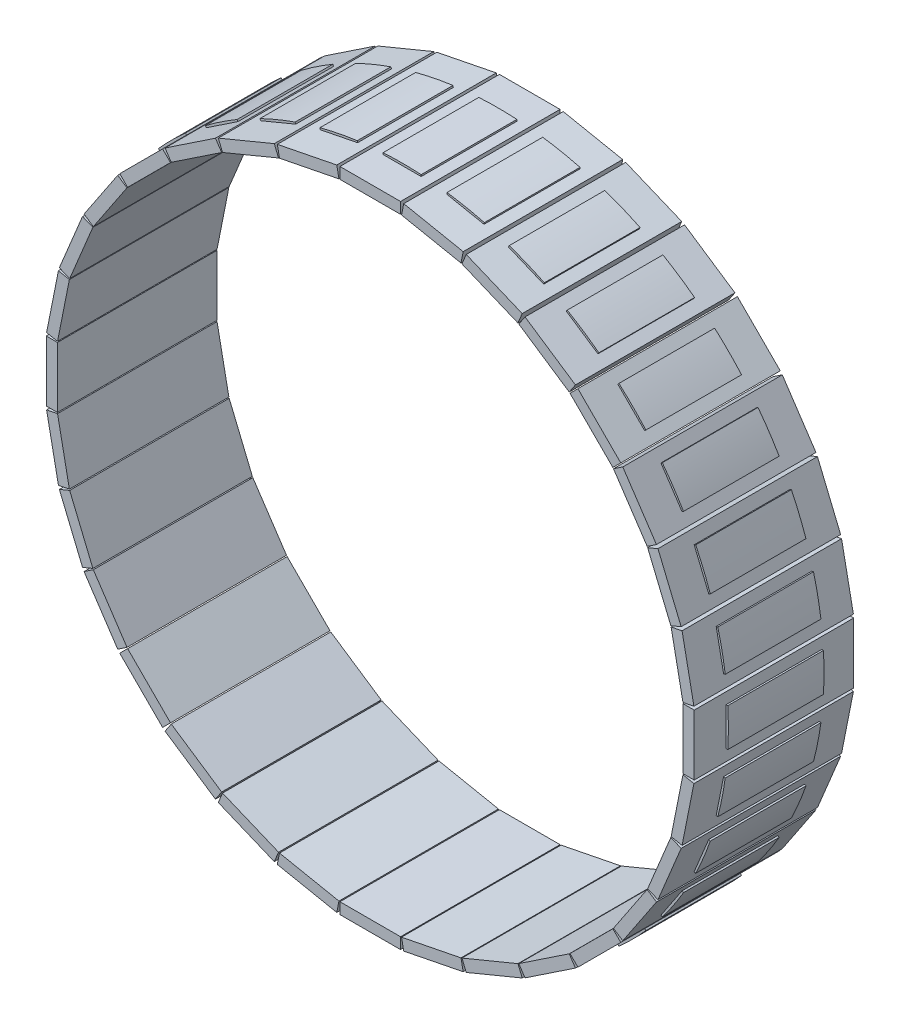
from build123d import *

# Parameters (mm, degrees)
SKETCH_1_W         = 19
SKETCH_1_H         = 3.5
EXTRUDE_1_DEPTH    = 50
EXTRUDE_1_2_DEPTH  = 50
EXTRUDE_1_3_DEPTH  = 50
EXTRUDE_1_4_DEPTH  = 50
EXTRUDE_1_5_DEPTH  = 50
EXTRUDE_1_6_DEPTH  = 50
EXTRUDE_1_7_DEPTH  = 50
EXTRUDE_1_8_DEPTH  = 50
SKETCH_1_W_2       = 3.5
SKETCH_1_H_2       = 19
EXTRUDE_1_9_DEPTH  = 50
EXTRUDE_1_10_DEPTH = 50
EXTRUDE_1_11_DEPTH = 50
EXTRUDE_1_12_DEPTH = 50
EXTRUDE_1_13_DEPTH = 50
EXTRUDE_1_14_DEPTH = 50
EXTRUDE_1_15_DEPTH = 50
EXTRUDE_1_16_DEPTH = 50
EXTRUDE_1_17_DEPTH = 50
EXTRUDE_1_18_DEPTH = 50
EXTRUDE_1_19_DEPTH = 50
EXTRUDE_1_20_DEPTH = 50
EXTRUDE_1_21_DEPTH = 50
EXTRUDE_1_22_DEPTH = 50
EXTRUDE_1_23_DEPTH = 50
EXTRUDE_1_24_DEPTH = 50
EXTRUDE_1_25_DEPTH = 50
EXTRUDE_1_26_DEPTH = 50
EXTRUDE_1_27_DEPTH = 50
EXTRUDE_1_28_DEPTH = 50
EXTRUDE_1_29_DEPTH = 50
EXTRUDE_1_30_DEPTH = 50
EXTRUDE_1_31_DEPTH = 50
EXTRUDE_1_32_DEPTH = 50
EXTRUDE_START      = -10
EXTRUDE_2_DEPTH    = 30


with BuildPart() as part:
    # Эскиз1 → Бобышка-Вытянуть1 (new body)
    with BuildSketch(Plane.XY):
        with Locations((0, 99.806634446)):
            Rectangle(SKETCH_1_W, SKETCH_1_H)
    extrude(amount=EXTRUDE_1_DEPTH)

    # Эскиз2 → Бобышка-Вытянуть2 (add)
    with BuildSketch(Plane.XY.offset(50).offset(EXTRUDE_START)):
        with BuildLine():
            Line((-5.965692054, 102.075819949), (-5.965692054, 100.533088049))
            Line((-5.965692054, 100.533088049), (5.965692054, 100.533088049))
            Line((5.965692054, 100.533088049), (5.965692054, 102.075819949))
            ThreePointArc((5.965692054, 102.075819949), (0, 102.25), (-5.965692054, 102.075819949))
        make_face()
        with BuildLine():
            Line((25.464095475, 97.437524168), (25.765067538, 98.950612907))
            ThreePointArc((25.765067538, 98.950612907), (19.947985426, 100.285294921), (14.06294163, 101.278310475))
            Line((14.06294163, 101.278310475), (13.761969566, 99.765221736))
            Line((13.761969566, 99.765221736), (25.464095475, 97.437524168))
        make_face()
        with BuildLine():
            Line((43.983927987, 90.597490877), (44.574305926, 92.022789304))
            ThreePointArc((44.574305926, 92.022789304), (39.129380959, 94.466682199), (33.551144353, 96.588732327))
            Line((33.551144353, 96.588732327), (32.960766414, 95.1634339))
            Line((32.960766414, 95.1634339), (43.983927987, 90.597490877))
        make_face()
        with BuildLine():
            Line((60.813482813, 80.275846819), (61.670578734, 81.558581514))
            ThreePointArc((61.670578734, 81.558581514), (56.807056326, 85.017767858), (51.749995415, 88.187303363))
            Line((51.749995415, 88.187303363), (50.892899494, 86.904568668))
            Line((50.892899494, 86.904568668), (60.813482813, 80.275846819))
        make_face()
        with BuildLine():
            Line((75.306009599, 66.869246987), (76.396885787, 67.960123175))
            ThreePointArc((76.396885787, 67.960123175), (72.301668376, 72.301668376), (67.960123175, 76.396885787))
            Line((67.960123175, 76.396885787), (66.869246987, 75.306009599))
            Line((66.869246987, 75.306009599), (75.306009599, 66.869246987))
        make_face()
        with BuildLine():
            Line((86.904568668, 50.892899494), (88.187303363, 51.749995415))
            ThreePointArc((88.187303363, 51.749995415), (85.017767858, 56.807056326), (81.558581514, 61.670578734))
            Line((81.558581514, 61.670578734), (80.275846819, 60.813482813))
            Line((80.275846819, 60.813482813), (86.904568668, 50.892899494))
        make_face()
        with BuildLine():
            Line((95.1634339, 32.960766414), (96.588732327, 33.551144353))
            ThreePointArc((96.588732327, 33.551144353), (94.466682199, 39.129380959), (92.022789304, 44.574305926))
            Line((92.022789304, 44.574305926), (90.597490877, 43.983927987))
            Line((90.597490877, 43.983927987), (95.1634339, 32.960766414))
        make_face()
        with BuildLine():
            Line((99.765221736, 13.761969566), (101.278310475, 14.06294163))
            ThreePointArc((101.278310475, 14.06294163), (100.285294921, 19.947985426), (98.950612907, 25.765067538))
            Line((98.950612907, 25.765067538), (97.437524168, 25.464095475))
            Line((97.437524168, 25.464095475), (99.765221736, 13.761969566))
        make_face()
        with BuildLine():
            Line((100.533088049, -5.965692054), (102.075819949, -5.965692054))
            ThreePointArc((102.075819949, -5.965692054), (102.25, 0), (102.075819949, 5.965692054))
            Line((102.075819949, 5.965692054), (100.533088049, 5.965692054))
            Line((100.533088049, 5.965692054), (100.533088049, -5.965692054))
        make_face()
        with BuildLine():
            Line((97.437524168, -25.464095475), (98.950612907, -25.765067538))
            ThreePointArc((98.950612907, -25.765067538), (100.285294921, -19.947985426), (101.278310475, -14.06294163))
            Line((101.278310475, -14.06294163), (99.765221736, -13.761969566))
            Line((99.765221736, -13.761969566), (97.437524168, -25.464095475))
        make_face()
        with BuildLine():
            Line((90.597490877, -43.983927987), (92.022789304, -44.574305926))
            ThreePointArc((92.022789304, -44.574305926), (94.466682199, -39.129380959), (96.588732327, -33.551144353))
            Line((96.588732327, -33.551144353), (95.1634339, -32.960766414))
            Line((95.1634339, -32.960766414), (90.597490877, -43.983927987))
        make_face()
        with BuildLine():
            Line((80.275846819, -60.813482813), (81.558581514, -61.670578734))
            ThreePointArc((81.558581514, -61.670578734), (85.017767858, -56.807056326), (88.187303363, -51.749995415))
            Line((88.187303363, -51.749995415), (86.904568668, -50.892899494))
            Line((86.904568668, -50.892899494), (80.275846819, -60.813482813))
        make_face()
        with BuildLine():
            Line((66.869246987, -75.306009599), (67.960123175, -76.396885787))
            ThreePointArc((67.960123175, -76.396885787), (72.301668376, -72.301668376), (76.396885787, -67.960123175))
            Line((76.396885787, -67.960123175), (75.306009599, -66.869246987))
            Line((75.306009599, -66.869246987), (66.869246987, -75.306009599))
        make_face()
        with BuildLine():
            Line((50.892899494, -86.904568668), (51.749995415, -88.187303363))
            ThreePointArc((51.749995415, -88.187303363), (56.807056326, -85.017767858), (61.670578734, -81.558581514))
            Line((61.670578734, -81.558581514), (60.813482813, -80.275846819))
            Line((60.813482813, -80.275846819), (50.892899494, -86.904568668))
        make_face()
        with BuildLine():
            Line((32.960766414, -95.1634339), (33.551144353, -96.588732327))
            ThreePointArc((33.551144353, -96.588732327), (39.129380959, -94.466682199), (44.574305926, -92.022789304))
            Line((44.574305926, -92.022789304), (43.983927987, -90.597490877))
            Line((43.983927987, -90.597490877), (32.960766414, -95.1634339))
        make_face()
        with BuildLine():
            Line((13.761969566, -99.765221736), (14.06294163, -101.278310475))
            ThreePointArc((14.06294163, -101.278310475), (19.947985426, -100.285294921), (25.765067538, -98.950612907))
            Line((25.765067538, -98.950612907), (25.464095475, -97.437524168))
            Line((25.464095475, -97.437524168), (13.761969566, -99.765221736))
        make_face()
        with BuildLine():
            Line((-5.965692054, -100.533088049), (-5.965692054, -102.075819949))
            ThreePointArc((-5.965692054, -102.075819949), (0, -102.25), (5.965692054, -102.075819949))
            Line((5.965692054, -102.075819949), (5.965692054, -100.533088049))
            Line((5.965692054, -100.533088049), (-5.965692054, -100.533088049))
        make_face()
        with BuildLine():
            Line((-25.464095475, -97.437524168), (-25.765067538, -98.950612907))
            ThreePointArc((-25.765067538, -98.950612907), (-19.947985426, -100.285294921), (-14.06294163, -101.278310475))
            Line((-14.06294163, -101.278310475), (-13.761969566, -99.765221736))
            Line((-13.761969566, -99.765221736), (-25.464095475, -97.437524168))
        make_face()
        with BuildLine():
            Line((-43.983927987, -90.597490877), (-44.574305926, -92.022789304))
            ThreePointArc((-44.574305926, -92.022789304), (-39.129380959, -94.466682199), (-33.551144353, -96.588732327))
            Line((-33.551144353, -96.588732327), (-32.960766414, -95.1634339))
            Line((-32.960766414, -95.1634339), (-43.983927987, -90.597490877))
        make_face()
        with BuildLine():
            Line((-60.813482813, -80.275846819), (-61.670578734, -81.558581514))
            ThreePointArc((-61.670578734, -81.558581514), (-56.807056326, -85.017767858), (-51.749995415, -88.187303363))
            Line((-51.749995415, -88.187303363), (-50.892899494, -86.904568668))
            Line((-50.892899494, -86.904568668), (-60.813482813, -80.275846819))
        make_face()
        with BuildLine():
            Line((-75.306009599, -66.869246987), (-76.396885787, -67.960123175))
            ThreePointArc((-76.396885787, -67.960123175), (-72.301668376, -72.301668376), (-67.960123175, -76.396885787))
            Line((-67.960123175, -76.396885787), (-66.869246987, -75.306009599))
            Line((-66.869246987, -75.306009599), (-75.306009599, -66.869246987))
        make_face()
        with BuildLine():
            Line((-86.904568668, -50.892899494), (-88.187303363, -51.749995415))
            ThreePointArc((-88.187303363, -51.749995415), (-85.017767858, -56.807056326), (-81.558581514, -61.670578734))
            Line((-81.558581514, -61.670578734), (-80.275846819, -60.813482813))
            Line((-80.275846819, -60.813482813), (-86.904568668, -50.892899494))
        make_face()
        with BuildLine():
            Line((-95.1634339, -32.960766414), (-96.588732327, -33.551144353))
            ThreePointArc((-96.588732327, -33.551144353), (-94.466682199, -39.129380959), (-92.022789304, -44.574305926))
            Line((-92.022789304, -44.574305926), (-90.597490877, -43.983927987))
            Line((-90.597490877, -43.983927987), (-95.1634339, -32.960766414))
        make_face()
        with BuildLine():
            Line((-99.765221736, -13.761969566), (-101.278310475, -14.06294163))
            ThreePointArc((-101.278310475, -14.06294163), (-100.285294921, -19.947985426), (-98.950612907, -25.765067538))
            Line((-98.950612907, -25.765067538), (-97.437524168, -25.464095475))
            Line((-97.437524168, -25.464095475), (-99.765221736, -13.761969566))
        make_face()
        with BuildLine():
            Line((-100.533088049, 5.965692054), (-102.075819949, 5.965692054))
            ThreePointArc((-102.075819949, 5.965692054), (-102.25, 0), (-102.075819949, -5.965692054))
            Line((-102.075819949, -5.965692054), (-100.533088049, -5.965692054))
            Line((-100.533088049, -5.965692054), (-100.533088049, 5.965692054))
        make_face()
        with BuildLine():
            Line((-97.437524168, 25.464095475), (-98.950612907, 25.765067538))
            ThreePointArc((-98.950612907, 25.765067538), (-100.285294921, 19.947985426), (-101.278310475, 14.06294163))
            Line((-101.278310475, 14.06294163), (-99.765221736, 13.761969566))
            Line((-99.765221736, 13.761969566), (-97.437524168, 25.464095475))
        make_face()
        with BuildLine():
            Line((-90.597490877, 43.983927987), (-92.022789304, 44.574305926))
            ThreePointArc((-92.022789304, 44.574305926), (-94.466682199, 39.129380959), (-96.588732327, 33.551144353))
            Line((-96.588732327, 33.551144353), (-95.1634339, 32.960766414))
            Line((-95.1634339, 32.960766414), (-90.597490877, 43.983927987))
        make_face()
        with BuildLine():
            Line((-80.275846819, 60.813482813), (-81.558581514, 61.670578734))
            ThreePointArc((-81.558581514, 61.670578734), (-85.017767858, 56.807056326), (-88.187303363, 51.749995415))
            Line((-88.187303363, 51.749995415), (-86.904568668, 50.892899494))
            Line((-86.904568668, 50.892899494), (-80.275846819, 60.813482813))
        make_face()
        with BuildLine():
            Line((-66.869246987, 75.306009599), (-67.960123175, 76.396885787))
            ThreePointArc((-67.960123175, 76.396885787), (-72.301668376, 72.301668376), (-76.396885787, 67.960123175))
            Line((-76.396885787, 67.960123175), (-75.306009599, 66.869246987))
            Line((-75.306009599, 66.869246987), (-66.869246987, 75.306009599))
        make_face()
        with BuildLine():
            Line((-50.892899494, 86.904568668), (-51.749995415, 88.187303363))
            ThreePointArc((-51.749995415, 88.187303363), (-56.807056326, 85.017767858), (-61.670578734, 81.558581514))
            Line((-61.670578734, 81.558581514), (-60.813482813, 80.275846819))
            Line((-60.813482813, 80.275846819), (-50.892899494, 86.904568668))
        make_face()
        with BuildLine():
            Line((-32.960766414, 95.1634339), (-33.551144353, 96.588732327))
            ThreePointArc((-33.551144353, 96.588732327), (-39.129380959, 94.466682199), (-44.574305926, 92.022789304))
            Line((-44.574305926, 92.022789304), (-43.983927987, 90.597490877))
            Line((-43.983927987, 90.597490877), (-32.960766414, 95.1634339))
        make_face()
        with BuildLine():
            Line((-13.761969566, 99.765221736), (-14.06294163, 101.278310475))
            ThreePointArc((-14.06294163, 101.278310475), (-19.947985426, 100.285294921), (-25.765067538, 98.950612907))
            Line((-25.765067538, 98.950612907), (-25.464095475, 97.437524168))
            Line((-25.464095475, 97.437524168), (-13.761969566, 99.765221736))
        make_face()
    extrude(amount=-EXTRUDE_2_DEPTH)


with BuildPart() as body_2:
    # Эскиз1 → Extrude 1 2 (new body)
    with BuildSketch(Plane.XY):
        Polygon((10.495256353, 101.458610251), (9.812440226, 98.02586177), (28.447360554, 94.319145651), (29.130176681, 97.751894133), align=None)
    extrude(amount=EXTRUDE_1_2_DEPTH)


with BuildPart() as body_3:
    # Эскиз1 → Extrude 1 3 (new body)
    with BuildSketch(Plane.XY):
        Polygon((30.08718589, 97.461588563), (28.747793877, 94.228010199), (46.301504995, 86.957024984), (47.640897008, 90.190603348), align=None)
    extrude(amount=EXTRUDE_1_3_DEPTH)


with BuildPart() as body_4:
    # Эскиз1 → Extrude 1 4 (new body)
    with BuildSketch(Plane.XY):
        Polygon((48.522881747, 89.719172683), (46.578385931, 86.80902904), (62.376308565, 76.253194613), (64.320804381, 79.163338256), align=None)
    extrude(amount=EXTRUDE_1_4_DEPTH)


with BuildPart() as body_5:
    # Эскиз1 → Extrude 1 5 (new body)
    with BuildSketch(Plane.XY):
        Polygon((65.09387047, 78.528899313), (62.618996736, 76.054025578), (76.054025578, 62.618996736), (78.528899313, 65.09387047), align=None)
    extrude(amount=EXTRUDE_1_5_DEPTH)


with BuildPart() as body_6:
    # Эскиз1 → Extrude 1 6 (new body)
    with BuildSketch(Plane.XY):
        Polygon((79.163338256, 64.320804381), (76.253194613, 62.376308565), (86.80902904, 46.578385931), (89.719172683, 48.522881747), align=None)
    extrude(amount=EXTRUDE_1_6_DEPTH)


with BuildPart() as body_7:
    # Эскиз1 → Extrude 1 7 (new body)
    with BuildSketch(Plane.XY):
        Polygon((90.190603348, 47.640897008), (86.957024984, 46.301504995), (94.228010199, 28.747793877), (97.461588563, 30.08718589), align=None)
    extrude(amount=EXTRUDE_1_7_DEPTH)


with BuildPart() as body_8:
    # Эскиз1 → Extrude 1 8 (new body)
    with BuildSketch(Plane.XY):
        Polygon((97.751894133, 29.130176681), (94.319145651, 28.447360554), (98.02586177, 9.812440226), (101.458610251, 10.495256353), align=None)
    extrude(amount=EXTRUDE_1_8_DEPTH)


with BuildPart() as body_9:
    # Эскиз1 → Extrude 1 9 (new body)
    with BuildSketch(Plane.XY):
        with Locations((99.806634446, 0)):
            Rectangle(SKETCH_1_W_2, SKETCH_1_H_2)
    extrude(amount=EXTRUDE_1_9_DEPTH)


with BuildPart() as body_10:
    # Эскиз1 → Extrude 1 10 (new body)
    with BuildSketch(Plane.XY):
        Polygon((101.458610251, -10.495256353), (98.02586177, -9.812440226), (94.319145651, -28.447360554), (97.751894133, -29.130176681), align=None)
    extrude(amount=EXTRUDE_1_10_DEPTH)


with BuildPart() as body_11:
    # Эскиз1 → Extrude 1 11 (new body)
    with BuildSketch(Plane.XY):
        Polygon((97.461588563, -30.08718589), (94.228010199, -28.747793877), (86.957024984, -46.301504995), (90.190603348, -47.640897008), align=None)
    extrude(amount=EXTRUDE_1_11_DEPTH)


with BuildPart() as body_12:
    # Эскиз1 → Extrude 1 12 (new body)
    with BuildSketch(Plane.XY):
        Polygon((89.719172683, -48.522881747), (86.80902904, -46.578385931), (76.253194613, -62.376308565), (79.163338256, -64.320804381), align=None)
    extrude(amount=EXTRUDE_1_12_DEPTH)


with BuildPart() as body_13:
    # Эскиз1 → Extrude 1 13 (new body)
    with BuildSketch(Plane.XY):
        Polygon((78.528899313, -65.09387047), (76.054025578, -62.618996736), (62.618996736, -76.054025578), (65.09387047, -78.528899313), align=None)
    extrude(amount=EXTRUDE_1_13_DEPTH)


with BuildPart() as body_14:
    # Эскиз1 → Extrude 1 14 (new body)
    with BuildSketch(Plane.XY):
        Polygon((64.320804381, -79.163338256), (62.376308565, -76.253194613), (46.578385931, -86.80902904), (48.522881747, -89.719172683), align=None)
    extrude(amount=EXTRUDE_1_14_DEPTH)


with BuildPart() as body_15:
    # Эскиз1 → Extrude 1 15 (new body)
    with BuildSketch(Plane.XY):
        Polygon((47.640897008, -90.190603348), (46.301504995, -86.957024984), (28.747793877, -94.228010199), (30.08718589, -97.461588563), align=None)
    extrude(amount=EXTRUDE_1_15_DEPTH)


with BuildPart() as body_16:
    # Эскиз1 → Extrude 1 16 (new body)
    with BuildSketch(Plane.XY):
        Polygon((29.130176681, -97.751894133), (28.447360554, -94.319145651), (9.812440226, -98.02586177), (10.495256353, -101.458610251), align=None)
    extrude(amount=EXTRUDE_1_16_DEPTH)


with BuildPart() as body_17:
    # Эскиз1 → Extrude 1 17 (new body)
    with BuildSketch(Plane.XY):
        with Locations((0, -99.806634446)):
            Rectangle(SKETCH_1_W, SKETCH_1_H)
    extrude(amount=EXTRUDE_1_17_DEPTH)


with BuildPart() as body_18:
    # Эскиз1 → Extrude 1 18 (new body)
    with BuildSketch(Plane.XY):
        Polygon((-10.495256353, -101.458610251), (-9.812440226, -98.02586177), (-28.447360554, -94.319145651), (-29.130176681, -97.751894133), align=None)
    extrude(amount=EXTRUDE_1_18_DEPTH)


with BuildPart() as body_19:
    # Эскиз1 → Extrude 1 19 (new body)
    with BuildSketch(Plane.XY):
        Polygon((-30.08718589, -97.461588563), (-28.747793877, -94.228010199), (-46.301504995, -86.957024984), (-47.640897008, -90.190603348), align=None)
    extrude(amount=EXTRUDE_1_19_DEPTH)


with BuildPart() as body_20:
    # Эскиз1 → Extrude 1 20 (new body)
    with BuildSketch(Plane.XY):
        Polygon((-48.522881747, -89.719172683), (-46.578385931, -86.80902904), (-62.376308565, -76.253194613), (-64.320804381, -79.163338256), align=None)
    extrude(amount=EXTRUDE_1_20_DEPTH)


with BuildPart() as body_21:
    # Эскиз1 → Extrude 1 21 (new body)
    with BuildSketch(Plane.XY):
        Polygon((-65.09387047, -78.528899313), (-62.618996736, -76.054025578), (-76.054025578, -62.618996736), (-78.528899313, -65.09387047), align=None)
    extrude(amount=EXTRUDE_1_21_DEPTH)


with BuildPart() as body_22:
    # Эскиз1 → Extrude 1 22 (new body)
    with BuildSketch(Plane.XY):
        Polygon((-79.163338256, -64.320804381), (-76.253194613, -62.376308565), (-86.80902904, -46.578385931), (-89.719172683, -48.522881747), align=None)
    extrude(amount=EXTRUDE_1_22_DEPTH)


with BuildPart() as body_23:
    # Эскиз1 → Extrude 1 23 (new body)
    with BuildSketch(Plane.XY):
        Polygon((-90.190603348, -47.640897008), (-86.957024984, -46.301504995), (-94.228010199, -28.747793877), (-97.461588563, -30.08718589), align=None)
    extrude(amount=EXTRUDE_1_23_DEPTH)


with BuildPart() as body_24:
    # Эскиз1 → Extrude 1 24 (new body)
    with BuildSketch(Plane.XY):
        Polygon((-97.751894133, -29.130176681), (-94.319145651, -28.447360554), (-98.02586177, -9.812440226), (-101.458610251, -10.495256353), align=None)
    extrude(amount=EXTRUDE_1_24_DEPTH)


with BuildPart() as body_25:
    # Эскиз1 → Extrude 1 25 (new body)
    with BuildSketch(Plane.XY):
        with Locations((-99.806634446, 0)):
            Rectangle(SKETCH_1_W_2, SKETCH_1_H_2)
    extrude(amount=EXTRUDE_1_25_DEPTH)


with BuildPart() as body_26:
    # Эскиз1 → Extrude 1 26 (new body)
    with BuildSketch(Plane.XY):
        Polygon((-101.458610251, 10.495256353), (-98.02586177, 9.812440226), (-94.319145651, 28.447360554), (-97.751894133, 29.130176681), align=None)
    extrude(amount=EXTRUDE_1_26_DEPTH)


with BuildPart() as body_27:
    # Эскиз1 → Extrude 1 27 (new body)
    with BuildSketch(Plane.XY):
        Polygon((-97.461588563, 30.08718589), (-94.228010199, 28.747793877), (-86.957024984, 46.301504995), (-90.190603348, 47.640897008), align=None)
    extrude(amount=EXTRUDE_1_27_DEPTH)


with BuildPart() as body_28:
    # Эскиз1 → Extrude 1 28 (new body)
    with BuildSketch(Plane.XY):
        Polygon((-89.719172683, 48.522881747), (-86.80902904, 46.578385931), (-76.253194613, 62.376308565), (-79.163338256, 64.320804381), align=None)
    extrude(amount=EXTRUDE_1_28_DEPTH)


with BuildPart() as body_29:
    # Эскиз1 → Extrude 1 29 (new body)
    with BuildSketch(Plane.XY):
        Polygon((-78.528899313, 65.09387047), (-76.054025578, 62.618996736), (-62.618996736, 76.054025578), (-65.09387047, 78.528899313), align=None)
    extrude(amount=EXTRUDE_1_29_DEPTH)


with BuildPart() as body_30:
    # Эскиз1 → Extrude 1 30 (new body)
    with BuildSketch(Plane.XY):
        Polygon((-64.320804381, 79.163338256), (-62.376308565, 76.253194613), (-46.578385931, 86.80902904), (-48.522881747, 89.719172683), align=None)
    extrude(amount=EXTRUDE_1_30_DEPTH)


with BuildPart() as body_31:
    # Эскиз1 → Extrude 1 31 (new body)
    with BuildSketch(Plane.XY):
        Polygon((-47.640897008, 90.190603348), (-46.301504995, 86.957024984), (-28.747793877, 94.228010199), (-30.08718589, 97.461588563), align=None)
    extrude(amount=EXTRUDE_1_31_DEPTH)


with BuildPart() as body_32:
    # Эскиз1 → Extrude 1 32 (new body)
    with BuildSketch(Plane.XY):
        Polygon((-29.130176681, 97.751894133), (-28.447360554, 94.319145651), (-9.812440226, 98.02586177), (-10.495256353, 101.458610251), align=None)
    extrude(amount=EXTRUDE_1_32_DEPTH)


solid = Compound([part.part, body_2.part, body_3.part, body_4.part, body_5.part, body_6.part, body_7.part, body_8.part, body_9.part, body_10.part, body_11.part, body_12.part, body_13.part, body_14.part, body_15.part, body_16.part, body_17.part, body_18.part, body_19.part, body_20.part, body_21.part, body_22.part, body_23.part, body_24.part, body_25.part, body_26.part, body_27.part, body_28.part, body_29.part, body_30.part, body_31.part, body_32.part])
